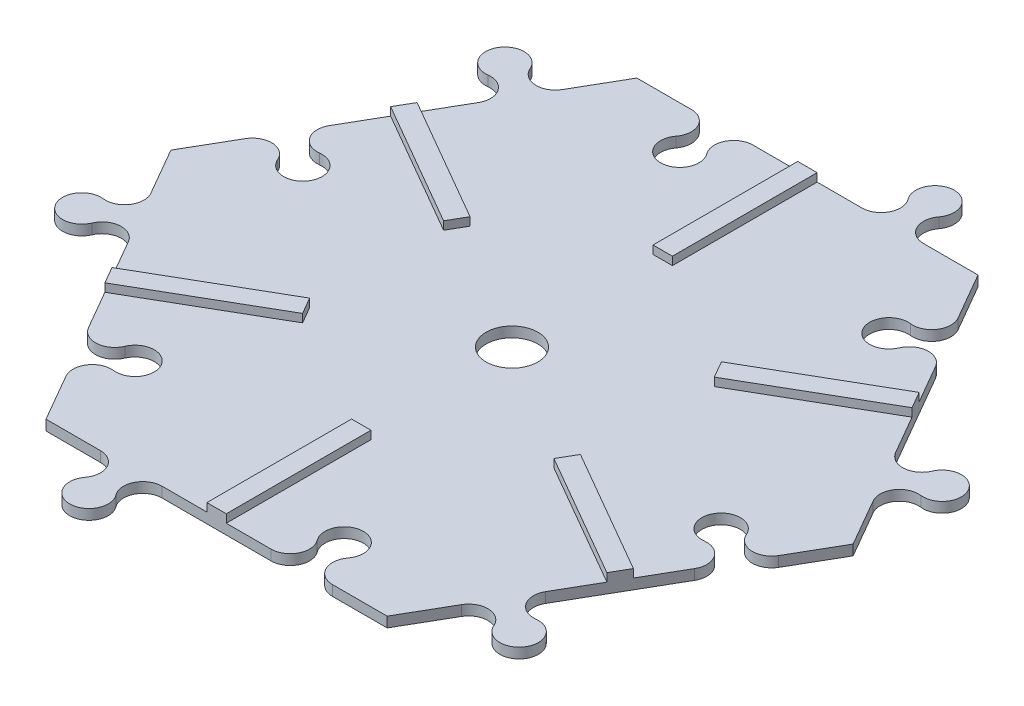
from build123d import *

# Parameters (mm, degrees)
BOSS_EXTRUDE1_DEPTH = 3.175
BOSS_EXTRUDE2_DEPTH = 3.175
CUT_EXTRUDE2_DEPTH  = 153.861000667
CIRPATTERN1_COUNT   = 6
SKETCH4_R           = 8.001
CUT_EXTRUDE3_DEPTH  = 3.175
BOSS_EXTRUDE3_DEPTH = 2.54
CIRPATTERN2_COUNT   = 6


with BuildPart() as part:
    # Sketch1 → Boss-Extrude1 (new body)
    with BuildSketch(Plane(origin=(0, 0, 0), x_dir=(1, 0, 0), z_dir=(0, 1, 0))):
        Polygon((52.792908615, -91.44), (105.585817229, 0), (52.792908615, 91.44), (-52.792908615, 91.44), (-105.585817229, 0), (-52.792908615, -91.44), align=None)
    extrude(amount=BOSS_EXTRUDE1_DEPTH)

    # Sketch2 → Boss-Extrude2 (add)
    with BuildSketch(Plane(origin=(0, 0, 0), x_dir=(1, 0, 0), z_dir=(0, 1, 0))):
        with BuildLine():
            ThreePointArc((21.633954307, 100.965), (22.196091179, 94.730806564), (16.871454307, 91.44))
            Line((16.871454307, 91.44), (35.921454307, 91.44))
            ThreePointArc((35.921454307, 91.44), (30.596817436, 94.730806564), (31.158954307, 100.965))
            ThreePointArc((31.158954307, 100.965), (31.721091179, 107.199193436), (26.396454307, 110.49))
            ThreePointArc((26.396454307, 110.49), (21.071817436, 107.199193436), (21.633954307, 100.965))
        make_face()
    boss_extrude2 = extrude(amount=BOSS_EXTRUDE2_DEPTH)

    # Sketch2<3> → Cut-Extrude2 (cut, through all)
    with BuildSketch(Plane(origin=(0, 0, 0), x_dir=(1, 0, 0), z_dir=(0, 1, 0))):
        with BuildLine():
            Line((-16.871454307, 91.44), (-35.921454307, 91.44))
            ThreePointArc((-35.921454307, 91.44), (-30.596817436, 88.149193436), (-31.158954307, 81.915))
            ThreePointArc((-31.158954307, 81.915), (-31.721091179, 75.680806564), (-26.396454307, 72.39))
            ThreePointArc((-26.396454307, 72.39), (-21.071817436, 75.680806564), (-21.633954307, 81.915))
            ThreePointArc((-21.633954307, 81.915), (-22.196091179, 88.149193436), (-16.871454307, 91.44))
        make_face()
    cut_extrude2 = extrude(amount=CUT_EXTRUDE2_DEPTH, mode=Mode.SUBTRACT)

    # CirPattern1: Boss-Extrude2, Cut-Extrude2 ×6 about axis
    cirpattern1_axis = Axis((0, 0, 0), (0, 1, 0))
    add([boss_extrude2.rotate(cirpattern1_axis, i * 360 / CIRPATTERN1_COUNT) for i in range(1, CIRPATTERN1_COUNT)])
    add([cut_extrude2.rotate(cirpattern1_axis, i * 360 / CIRPATTERN1_COUNT) for i in range(1, CIRPATTERN1_COUNT)], mode=Mode.SUBTRACT)

    # Sketch4 → Cut-Extrude3 (cut)
    with BuildSketch(Plane(origin=(0, 3.175, 0), x_dir=(1, 0, 0), z_dir=(0, 1, 0))):
        with Locations(Location((0, 0, 0), (0, 0, 270))):
            Circle(SKETCH4_R)
    extrude(amount=-CUT_EXTRUDE3_DEPTH, mode=Mode.SUBTRACT)

    # Sketch5 → Boss-Extrude3 (add)
    with BuildSketch(Plane(origin=(0, 3.175, 0), x_dir=(1, 0, 0), z_dir=(0, 1, 0))):
        Polygon((-41.898432158, -20.72596947), (-80.689362922, -43.121923789), (-79.189362922, -45.72), (-40.398432158, -23.324045681), align=None)
        Polygon((-40.398432158, -23.324045681), (-79.189362922, -45.72), (-77.689362922, -48.318076211), (-38.898432158, -25.922121892), align=None)
    boss_extrude3 = extrude(amount=BOSS_EXTRUDE3_DEPTH)

    # CirPattern2: Boss-Extrude3 ×6 about axis
    cirpattern2_axis = Axis((0, 0, 0), (0, 1, 0))
    for i in range(1, CIRPATTERN2_COUNT):
        add(boss_extrude3.rotate(cirpattern2_axis, i * 360 / CIRPATTERN2_COUNT))


solid = part.part
